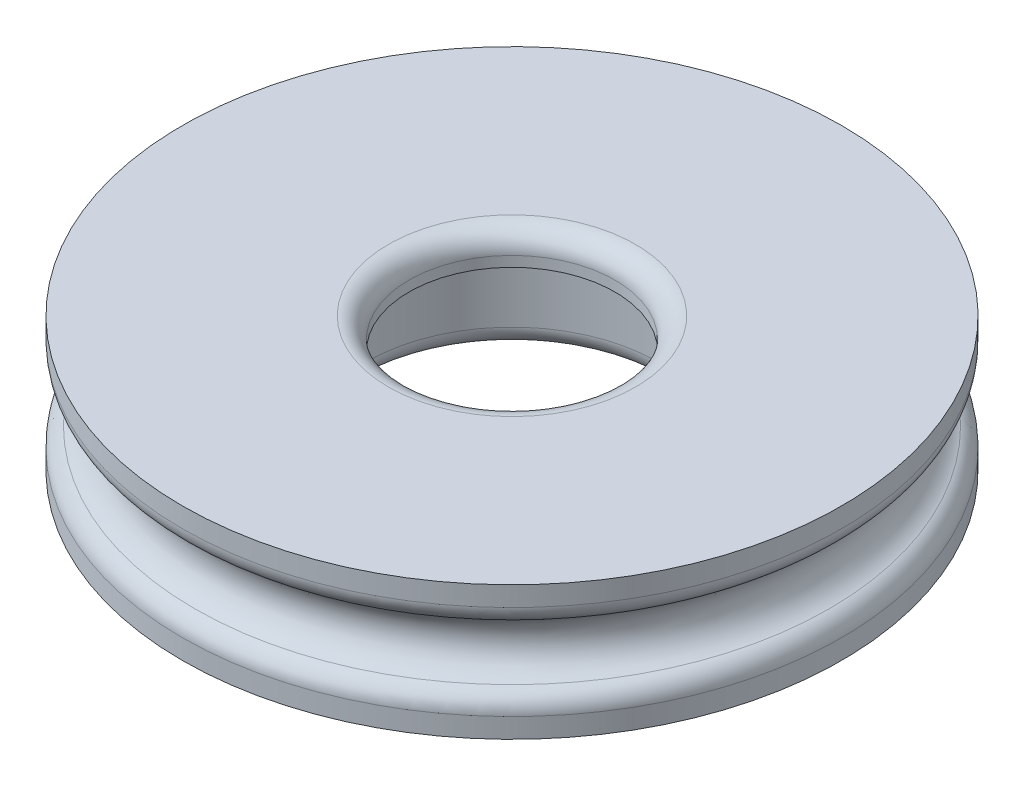
from build123d import *

# Parameters (mm, degrees)
SKETCH1_R           = 8
SKETCH1_R_2         = 3.55
BOSS_EXTRUDE1_DEPTH = 1.625
SKETCH3_R           = 4
SKETCH3_R_2         = 2.5
BOSS_EXTRUDE2_DEPTH = 0.75
FILLET1_R           = 0.5


with BuildPart() as part:
    # Sketch1 → Boss-Extrude1 (new, symmetric)
    with BuildSketch(Plane(origin=(0, 0, 0), x_dir=(1, 0, 0), z_dir=(0, 1, 0))):
        with Locations(Location((0, 0, 0), (0, 0, 90))):
            Circle(SKETCH1_R)
        with Locations(Location((0, 0, 0), (0, 0, 90))):
            Circle(SKETCH1_R_2, mode=Mode.SUBTRACT)
    extrude(amount=BOSS_EXTRUDE1_DEPTH, both=True)

    # Sketch2 → Cut-Revolve1 (revolve, cut)
    with BuildSketch(Plane(origin=(0, 0, 0), x_dir=(0, 0, -1), z_dir=(1, 0, 0)), mode=Mode.PRIVATE) as cut_revolve1_sk:
        with BuildLine():
            Line((-8, 0.75), (-8, -0.75))
            add(Edge.make_bspline(
                [(-8, -0.75), (-7.25, -0.75), (-7.25, 0), (-7.25, 0.75), (-8, 0.75)],
                knots=[4.71238898, 4.71238898, 4.71238898, 6.283185307, 6.283185307, 7.853981634, 7.853981634, 7.853981634], degree=2, weights=[1, 0.707106781, 1, 0.707106781, 1]))
        make_face()
    revolve(cut_revolve1_sk.sketch.rotate(Axis((0, 1.625, 0), (0, -1, 0)), 180), axis=Axis((0, 1.625, 0), (0, -1, 0)), mode=Mode.SUBTRACT)

    # Sketch3 → Boss-Extrude2 (add)
    with BuildSketch(Plane(origin=(0, 1.625, 0), x_dir=(1, 0, 0), z_dir=(0, 1, 0))):
        Circle(SKETCH3_R)
        with Locations(Location((0, 0, 0), (0, 0, 270))):
            Circle(SKETCH3_R_2, mode=Mode.SUBTRACT)
    extrude(amount=-BOSS_EXTRUDE2_DEPTH)

    # Fillet1
    fillet1_edges = [part.edges().sort_by_distance(p)[0] for p in [
        (0, 0.75, 8),
        (0, -0.75, 8),
        (0, 0.875, 3.55),
        (0, 1.625, -2.5),
        (0, -1.625, 3.55),
    ]]
    fillet(fillet1_edges, radius=FILLET1_R)


solid = part.part
